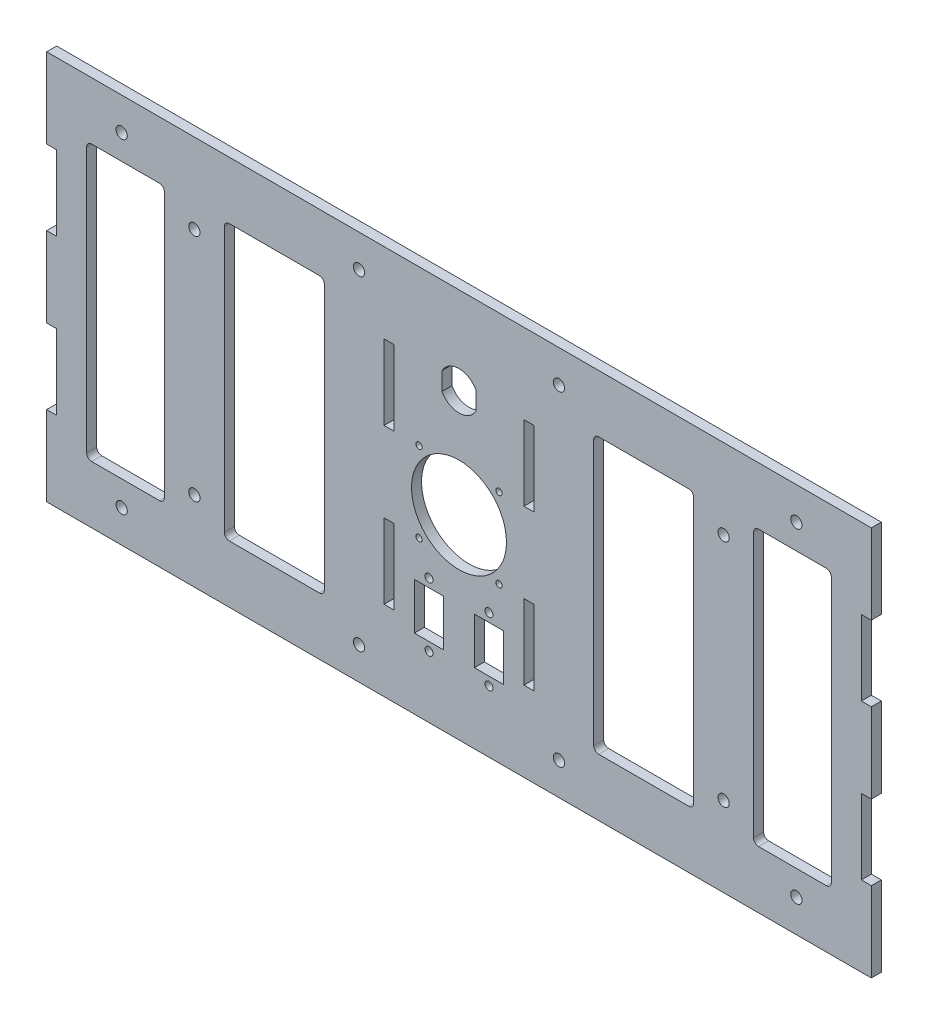
from build123d import *

# Parameters (mm, degrees)
SKIZZE1_W                       = 330
SKIZZE1_H                       = 156
AUFSATZ_LINEAR_AUSTRAGEN1_DEPTH = 4
SKIZZE2_R                       = 2.25
SKIZZE2_W                       = 31.1
SKIZZE2_H                       = 110
SCHNITT_LINEAR_AUSTRAGEN1_DEPTH = 183.551362635
M3_GEWINDEBOHRUNG1_D            = 2.5
SKIZZE5_R                       = 19
SCHNITT_LINEAR_AUSTRAGEN2_DEPTH = 183.551362635
VERRUNDUNG1_R                   = 2
SKIZZE7_R                       = 1.6
SKIZZE7_W                       = 11.7
SKIZZE7_H                       = 18.6
SCHNITT_LINEAR_AUSTRAGEN3_DEPTH = 183.551362635
SCHNITT_LINEAR_AUSTRAGEN4_DEPTH = 183.551362635
VERRUNDUNG2_R                   = 2
SKIZZE10_W                      = 4
SKIZZE10_H                      = 30
SCHNITT_LINEAR_AUSTRAGEN5_DEPTH = 183.551362635


with BuildPart() as part:
    # Skizze1 → Aufsatz-Linear austragen1 (new body)
    with BuildSketch(Plane.XY):
        Rectangle(SKIZZE1_W, SKIZZE1_H)
    extrude(amount=AUFSATZ_LINEAR_AUSTRAGEN1_DEPTH)

    # Skizze2 → Schnitt-Linear austragen1 (cut, through all)
    with BuildSketch(Plane.XY.offset(4)):
        with Locations((-105.9, 46)):
            Circle(SKIZZE2_R)
        with Locations((-105.9, -46)):
            Circle(SKIZZE2_R)
        with Locations((105.9, -46)):
            Circle(SKIZZE2_R)
        with Locations((105.9, 46)):
            Circle(SKIZZE2_R)
        with Locations((-40, 65)):
            Circle(SKIZZE2_R)
        with Locations((40, 65)):
            Circle(SKIZZE2_R)
        with Locations((-40, -65)):
            Circle(SKIZZE2_R)
        with Locations((40, -65)):
            Circle(SKIZZE2_R)
        with Locations((-135, -65)):
            Circle(SKIZZE2_R)
        with Locations((-135, 65)):
            Circle(SKIZZE2_R)
        with Locations(Location((135, -65, 0), (0, 0, 180))):
            Circle(SKIZZE2_R)
        with Locations(Location((135, 65, 0), (0, 0, 180))):
            Circle(SKIZZE2_R)
        with Locations((133.45, 0)):
            Rectangle(SKIZZE2_W, SKIZZE2_H)
        with Locations((-133.45, 0)):
            Rectangle(SKIZZE2_W, SKIZZE2_H)
    extrude(amount=-SCHNITT_LINEAR_AUSTRAGEN1_DEPTH, mode=Mode.SUBTRACT)

    # M3 Gewindebohrung1 (through all)
    with Locations(Plane.XY.offset(4)):
        with Locations((16, -16), (0, 0), (16, 16), (-16, -16), (-16, 16)):
            Hole(M3_GEWINDEBOHRUNG1_D / 2)

    # Skizze5 → Schnitt-Linear austragen2 (cut, through all)
    with BuildSketch(Plane.XY.offset(4)):
        Circle(SKIZZE5_R)
    extrude(amount=-SCHNITT_LINEAR_AUSTRAGEN2_DEPTH, mode=Mode.SUBTRACT)

    # Verrundung1
    verrundung1_edges = [part.edges().sort_by_distance(p)[0] for p in [
        (149, 55, 2),
        (149, -55, 2),
        (117.9, -55, 2),
        (117.9, 55, 2),
        (-149, -55, 2),
        (-149, 55, 2),
        (-117.9, 55, 2),
        (-117.9, -55, 2),
    ]]
    fillet(verrundung1_edges, radius=VERRUNDUNG1_R)

    # Skizze7 → Schnitt-Linear austragen3 (cut, through all)
    with BuildSketch(Plane.XY.offset(4)):
        with Locations((-12, -27.880186595)):
            Circle(SKIZZE7_R)
        with Locations((-12, -53.280186595)):
            Circle(SKIZZE7_R)
        with Locations(Location((12, -53.280186595, 0), (0, 0, 180))):
            Circle(SKIZZE7_R)
        with Locations(Location((12, -27.880186595, 0), (0, 0, 180))):
            Circle(SKIZZE7_R)
        with BuildLine():
            Line((-6.8, 46.612478374), (-6.8, 39.387521626))
            ThreePointArc((-6.8, 39.387521626), (0, 35.3), (6.8, 39.387521626))
            Line((6.8, 39.387521626), (6.8, 46.612478374))
            ThreePointArc((6.8, 46.612478374), (0, 50.7), (-6.8, 46.612478374))
        make_face()
        with Locations((-12, -40.580186595)):
            Rectangle(SKIZZE7_W, SKIZZE7_H)
        with Locations((12, -40.580186595)):
            Rectangle(SKIZZE7_W, SKIZZE7_H)
    extrude(amount=-SCHNITT_LINEAR_AUSTRAGEN3_DEPTH, mode=Mode.SUBTRACT)

    # Skizze9 → Schnitt-Linear austragen4 (cut, through all)
    with BuildSketch(Plane.XY.offset(4)):
        Polygon((53.9, 55), (53.9, 7), (53.9, -7), (53.9, -55), (93.9, -55), (93.9, -7), (93.9, 7), (93.9, 55), align=None)
        Polygon((53.9, 55), (53.9, 7), (53.9, -7), (53.9, -55), (93.9, -55), (93.9, -7), (93.9, 7), (93.9, 55), align=None)
        Polygon((-53.9, 7), (-53.9, -7), (-53.9, -55), (-93.9, -55), (-93.9, -7), (-93.9, 7), (-93.9, 55), (-53.9, 55), align=None)
    extrude(amount=-SCHNITT_LINEAR_AUSTRAGEN4_DEPTH, mode=Mode.SUBTRACT)

    # Verrundung2
    verrundung2_edges = [part.edges().sort_by_distance(p)[0] for p in [
        (93.9, 55, 2),
        (93.9, -55, 2),
        (53.9, -55, 2),
        (53.9, 55, 2),
        (-53.9, 55, 2),
        (-53.9, -55, 2),
        (-93.9, -55, 2),
        (-93.9, 55, 2),
    ]]
    fillet(verrundung2_edges, radius=VERRUNDUNG2_R)

    # Skizze10 → Schnitt-Linear austragen5 (cut, through all)
    with BuildSketch(Plane.XY.offset(4)):
        with Locations((-28, 31)):
            Rectangle(SKIZZE10_W, SKIZZE10_H)
        with Locations((-28, -31)):
            Rectangle(SKIZZE10_W, SKIZZE10_H)
        with Locations((28, -31)):
            Rectangle(SKIZZE10_W, SKIZZE10_H)
        with Locations((28, 31)):
            Rectangle(SKIZZE10_W, SKIZZE10_H)
        with Locations((-163, -31)):
            Rectangle(SKIZZE10_W, SKIZZE10_H)
        with Locations((-163, 31)):
            Rectangle(SKIZZE10_W, SKIZZE10_H)
        with Locations((163, -31)):
            Rectangle(SKIZZE10_W, SKIZZE10_H)
        with Locations((163, 31)):
            Rectangle(SKIZZE10_W, SKIZZE10_H)
    extrude(amount=-SCHNITT_LINEAR_AUSTRAGEN5_DEPTH, mode=Mode.SUBTRACT)


solid = part.part
